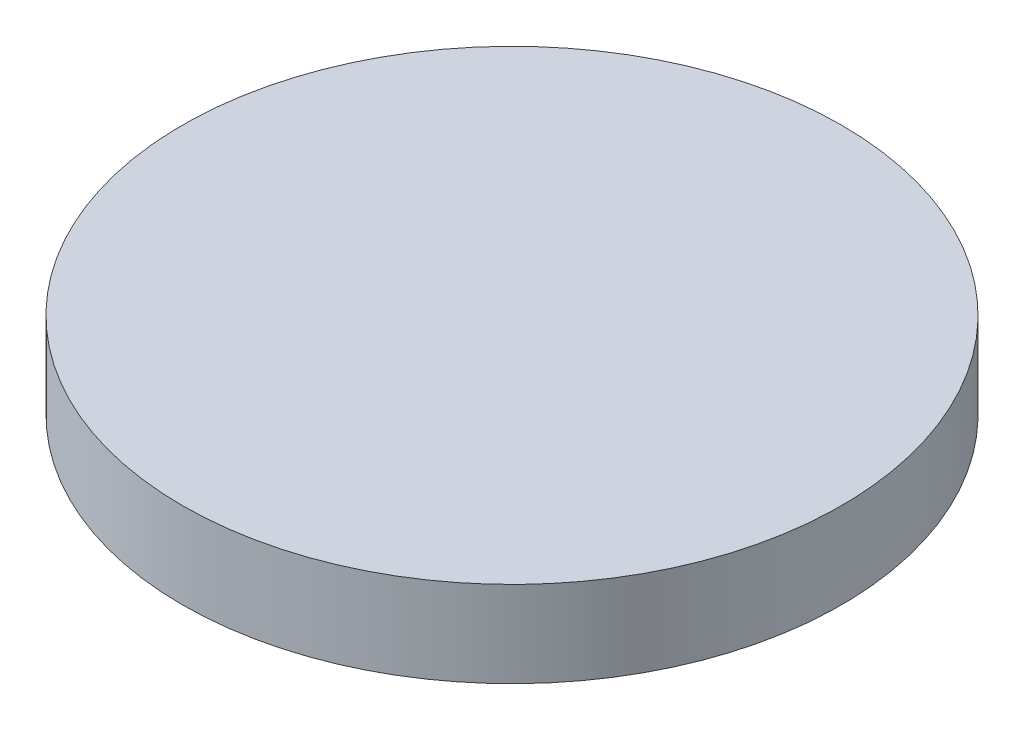
from build123d import *

# Parameters (mm, degrees)
SKETCH1_R           = 11.5
BOSS_EXTRUDE1_DEPTH = 1.5


with BuildPart() as part:
    # Sketch1 → Boss-Extrude1 (new, symmetric)
    with BuildSketch(Plane(origin=(0, 0, 0), x_dir=(1, 0, 0), z_dir=(0, 1, 0))):
        with Locations(Location((0, 0, 0), (0, 0, 270))):
            Circle(SKETCH1_R)
    extrude(amount=BOSS_EXTRUDE1_DEPTH, both=True)


solid = part.part
